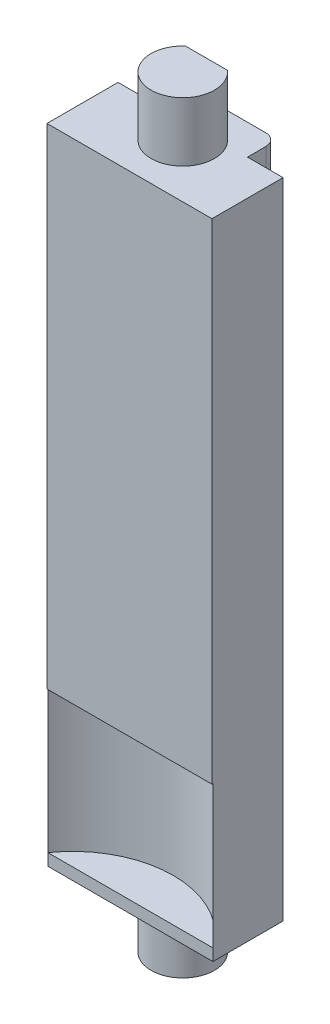
from build123d import *

# Parameters (mm, degrees)
BOSS_EXTRUDE1_DEPTH = 54.32
FILLET1_R           = 1
BOSS_EXTRUDE2_DEPTH = 5
SKETCH3_R           = 8.5
CUT_EXTRUDE1_DEPTH  = 13
BOSS_EXTRUDE3_DEPTH = 1


with BuildPart() as part:
    # Sketch1 → Boss-Extrude1 (new body)
    with BuildSketch(Plane(origin=(0, 0, 0), x_dir=(1, 0, 0), z_dir=(0, 1, 0))):
        Polygon((10.92, -2.55), (7.92, -2.55), (7.92, 0), (0, 0), (0, -2.55), (-3, -2.55), (-3, -8.55), (10.92, -8.55), align=None)
    extrude(amount=BOSS_EXTRUDE1_DEPTH)

    # Fillet1
    fillet1_edges = [part.edges().sort_by_distance(p)[0] for p in [
        (0, 27.16, 0),
        (7.92, 27.16, 0),
    ]]
    fillet(fillet1_edges, radius=FILLET1_R)

    # Sketch2 → Boss-Extrude2 (add)
    with BuildSketch(Plane(origin=(0, 54.32, 0), x_dir=(1, 0, 0), z_dir=(0, 1, 0))):
        with BuildLine():
            Line((5.736407892, -2.05), (2.183592108, -2.05))
            ThreePointArc((2.183592108, -2.05), (2.863703077, -6.490032388), (6.635, -4.05))
            ThreePointArc((6.635, -4.05), (6.400032388, -2.953703077), (5.736407892, -2.05))
        make_face()
    boss_extrude2 = extrude(amount=BOSS_EXTRUDE2_DEPTH)

    # Mirror1: Boss-Extrude2 across plane
    add(boss_extrude2.mirror(Plane.ZX.offset(27.16)))

    # Sketch3 → Cut-Extrude1 (cut)
    with BuildSketch(Plane.XZ):
        with Locations((3.96, 13.348484692)):
            Circle(SKETCH3_R)
    extrude(amount=-CUT_EXTRUDE1_DEPTH, mode=Mode.SUBTRACT)

    # Sketch4 → Boss-Extrude3 (add)
    with BuildSketch(Plane(origin=(0, 0, 0), x_dir=(1, 0, 0), z_dir=(0, 1, 0))):
        with BuildLine():
            Line((-3, -8.469099485), (10.92, -8.469099485))
            ThreePointArc((10.92, -8.469099485), (8.9248008, -6.449154796), (6.375674383, -5.198974445))
            ThreePointArc((6.375674383, -5.198974445), (3.96, -4.848484692), (1.544325617, -5.198974445))
            ThreePointArc((1.544325617, -5.198974445), (-1.0048008, -6.449154796), (-3, -8.469099485))
        make_face()
    extrude(amount=BOSS_EXTRUDE3_DEPTH)


solid = part.part
